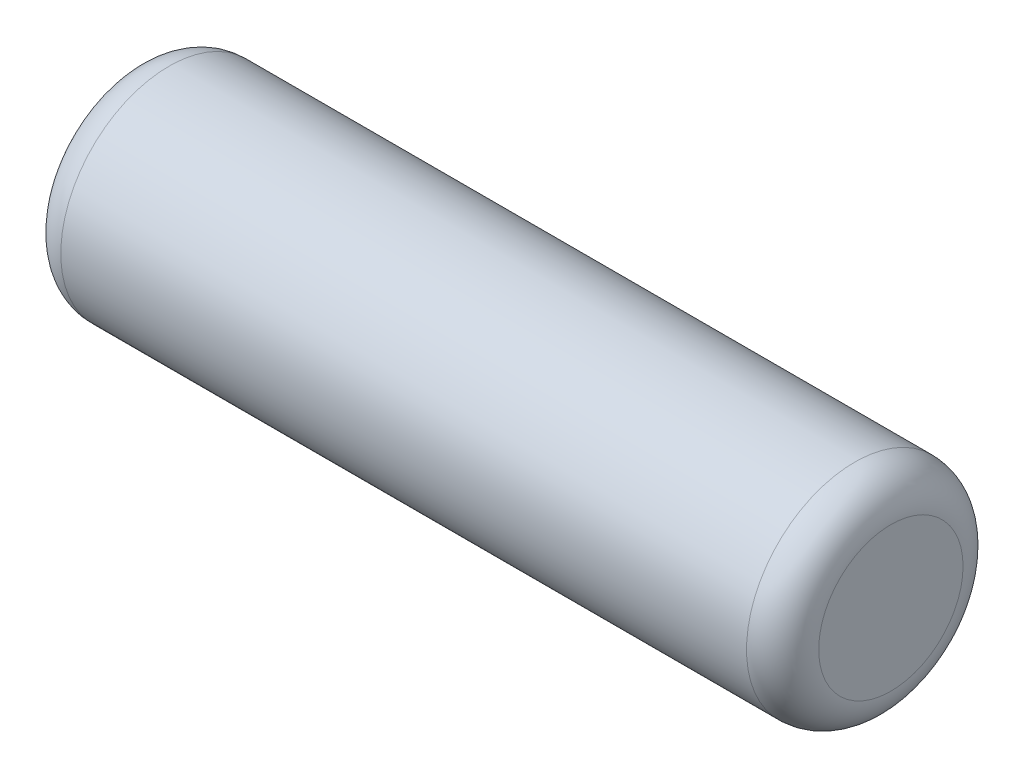
from build123d import *

# Parameters (mm, degrees)
SKETCH1_R           = 3.81
BOSS_EXTRUDE1_DEPTH = 26.67
FILLET1_R           = 1.27


with BuildPart() as part:
    # Sketch1 → Boss-Extrude1 (new body)
    with BuildSketch(Plane(origin=(0, 0, 0), x_dir=(0, 0, -1), z_dir=(1, 0, 0))):
        Circle(SKETCH1_R)
    extrude(amount=BOSS_EXTRUDE1_DEPTH)

    # Fillet1
    fillet1_edges = [part.edges().sort_by_distance(p)[0] for p in [
        (0, 0, 3.81),
        (26.67, 0, 3.81),
    ]]
    fillet(fillet1_edges, radius=FILLET1_R)


solid = part.part
